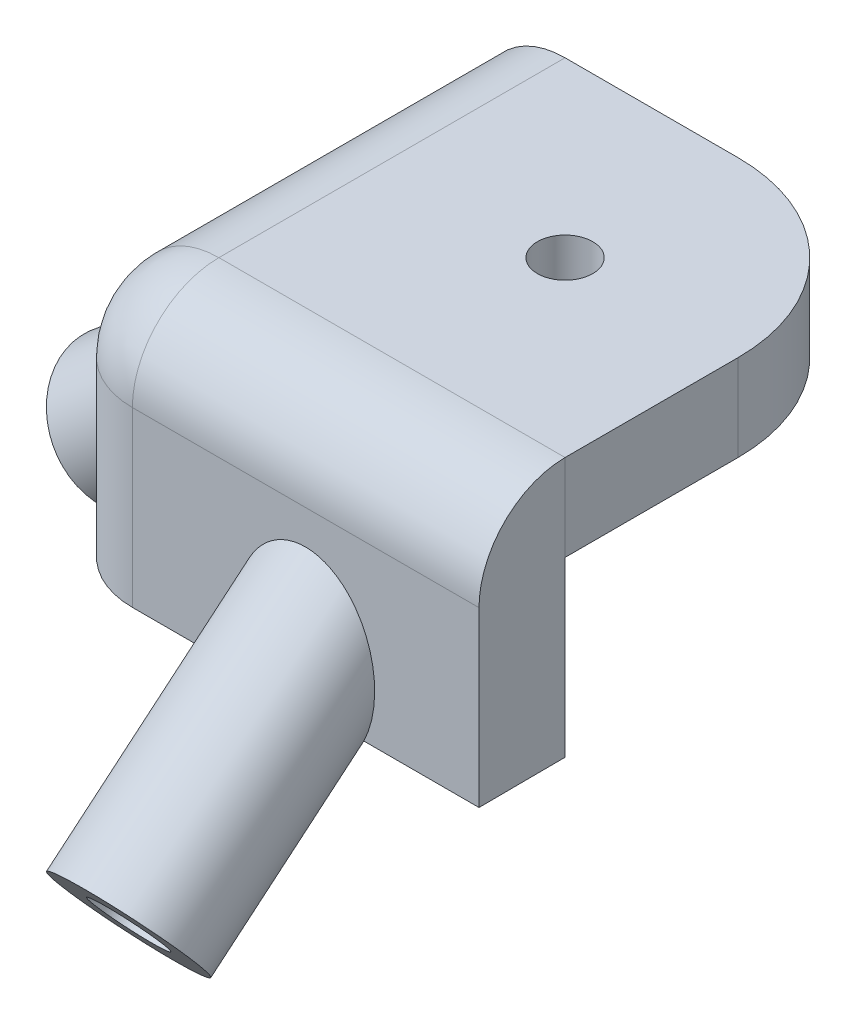
from build123d import *

# Parameters (mm, degrees)
SKETCH_1_W          = 20
SKETCH_1_H          = 20
EXTRUDE_1_DEPTH     = 8
SKETCH_2_R          = 4
EXTRUDE_2_DEPTH     = 25
SKETCH_3_R          = 4
EXTRUDE_3_DEPTH     = 25
SKETCH_4_R          = 1.6
CUT_EXTRUDE_1_DEPTH = 46.952030516
EXTRUDE_4_DEPTH     = 15
CUT_EXTRUDE_START   = -10
CUT_EXTRUDE_5_DEPTH = 10
SKETCH_11_R         = 2.05
CUT_EXTRUDE_6_DEPTH = 10
SKETCH_12_R         = 2.05
CUT_EXTRUDE_7_DEPTH = 10
FILLET_3_R          = 5


with BuildPart() as part:
    # 草圖1 → 填料-伸長1 (new body)
    with BuildSketch(Plane(origin=(0, 0, 0), x_dir=(1, 0, 0), z_dir=(0, 1, 0))):
        Rectangle(SKETCH_1_W, SKETCH_1_H)
    extrude(amount=EXTRUDE_1_DEPTH)

    # 草圖2 → 填料-伸長2 (add)
    with BuildSketch(Plane(origin=(0, -1.618631476, 1.929009876), x_dir=(1, 0, 0), z_dir=(0, -0.6427876096865406, 0.7660444431189771))):
        with Locations((0, 6.427876097)):
            Circle(SKETCH_2_R)
    extrude(amount=EXTRUDE_2_DEPTH)

    # 草圖3 → 填料-伸長3 (add)
    with BuildSketch(Plane(origin=(-1.929009876, -1.618631476, 0), x_dir=(0, 0, 1), z_dir=(-0.7660444431189771, -0.6427876096865406, 0))):
        with Locations((0, 6.427876097)):
            Circle(SKETCH_3_R)
    extrude(amount=EXTRUDE_3_DEPTH)

    # 草圖4 → 除料-伸長1 (cut, through all)
    with BuildSketch(Plane(origin=(0, 8, 0), x_dir=(1, 0, 0), z_dir=(0, 1, 0))):
        with Locations(Location((0, 0, 0), (0, 0, 270))):
            Circle(SKETCH_4_R)
        with BuildLine():
            Line((0, 10), (10, 10))
            Line((10, 10), (10, 0))
            ThreePointArc((10, 0), (7.071067812, 7.071067812), (0, 10))
        make_face()
    extrude(amount=-CUT_EXTRUDE_1_DEPTH, mode=Mode.SUBTRACT)

    # 草圖9 → 填料-伸長4 (add)
    with BuildSketch(Plane(origin=(0, 8, 0), x_dir=(1, 0, 0), z_dir=(0, 1, 0))):
        Polygon((-10, 10), (-15, 10), (-15, -15), (10.028553892, -15), (10, -10), (-10, -10), align=None)
    extrude(amount=-EXTRUDE_4_DEPTH)

    # 草圖10 → 除料-伸長5 (cut)
    with BuildSketch(Plane.XZ.offset(7).offset(CUT_EXTRUDE_START)):
        with BuildLine():
            Line((10, 0), (10, 10))
            Line((10, 10), (-10, 10))
            Line((-10, 10), (-10, -10))
            Line((-10, -10), (0, -10))
            ThreePointArc((0, -10), (7.071067812, -7.071067812), (10, 0))
        make_face()
    extrude(amount=CUT_EXTRUDE_5_DEPTH, mode=Mode.SUBTRACT)

    # 草圖11 → 除料-伸長6 (cut)
    with BuildSketch(Plane(origin=(-21.080120954, -17.688321718, 0), x_dir=(0, 0, 1), z_dir=(-0.7660444431189772, -0.6427876096865405, 0))):
        with Locations(Location((0, 6.427876097, 0), (0, 0, 270))):
            Circle(SKETCH_11_R)
    extrude(amount=-CUT_EXTRUDE_6_DEPTH, mode=Mode.SUBTRACT)

    # 草圖12 → 除料-伸長7 (cut)
    with BuildSketch(Plane(origin=(0, -17.688321718, 21.080120954), x_dir=(1, 0, 0), z_dir=(0, -0.6427876096865405, 0.7660444431189771))):
        with Locations(Location((0, 6.427876097, 0), (0, 0, 270))):
            Circle(SKETCH_12_R)
    extrude(amount=-CUT_EXTRUDE_7_DEPTH, mode=Mode.SUBTRACT)

    # 圓角3
    fillet_3_edges = [part.edges().sort_by_distance(p)[0] for p in [
        (-2.485723054, 8, 15),
        (-15, 8, 2.5),
        (-15, 0.5, 15),
    ]]
    fillet(fillet_3_edges, radius=FILLET_3_R)


solid = part.part
